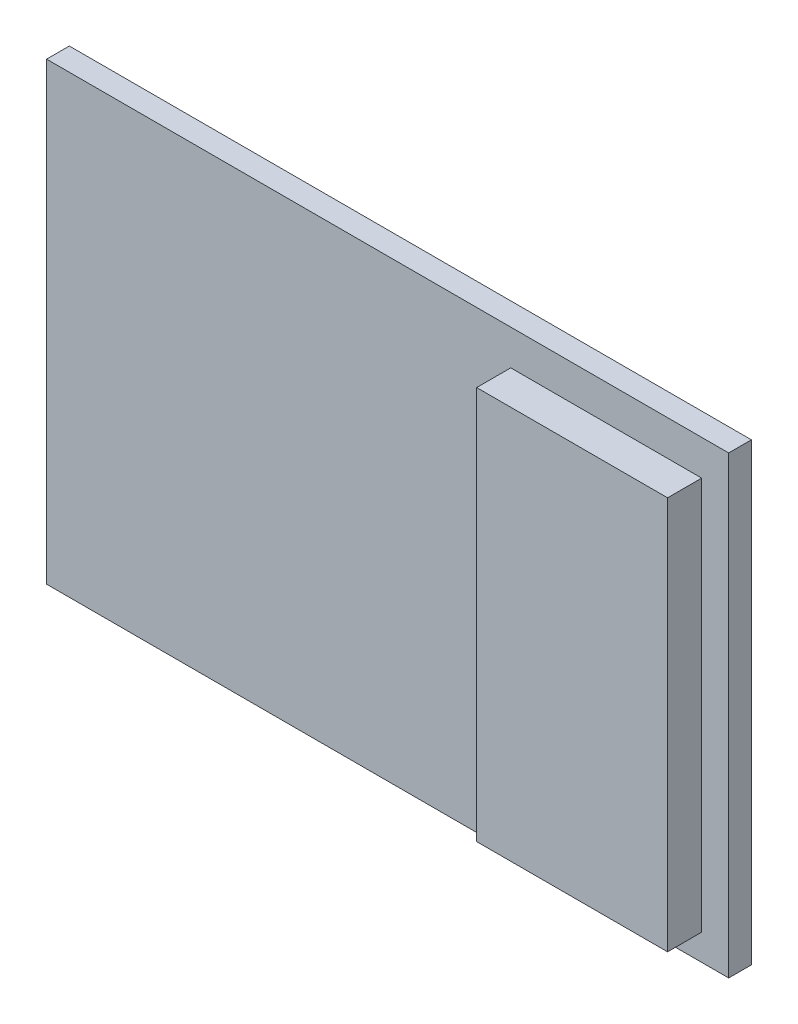
from build123d import *

# Parameters (mm, degrees)
ESQUISSE1_W        = 60
ESQUISSE1_H        = 40
BOSS_EXTRU_1_DEPTH = 2
ESQUISSE2_W        = 16.795540574
ESQUISSE2_H        = 34.590815706
BOSS_EXTRU_2_DEPTH = 3


with BuildPart() as part:
    # Esquisse1 → Boss.-Extru.1 (new body)
    with BuildSketch(Plane.XY):
        Rectangle(ESQUISSE1_W, ESQUISSE1_H)
    extrude(amount=BOSS_EXTRU_1_DEPTH)

    # Esquisse2 → Boss.-Extru.2 (add)
    with BuildSketch(Plane.XY.offset(2)):
        with Locations((19.228227999, -0.399893823)):
            Rectangle(ESQUISSE2_W, ESQUISSE2_H)
    extrude(amount=BOSS_EXTRU_2_DEPTH)


solid = part.part
